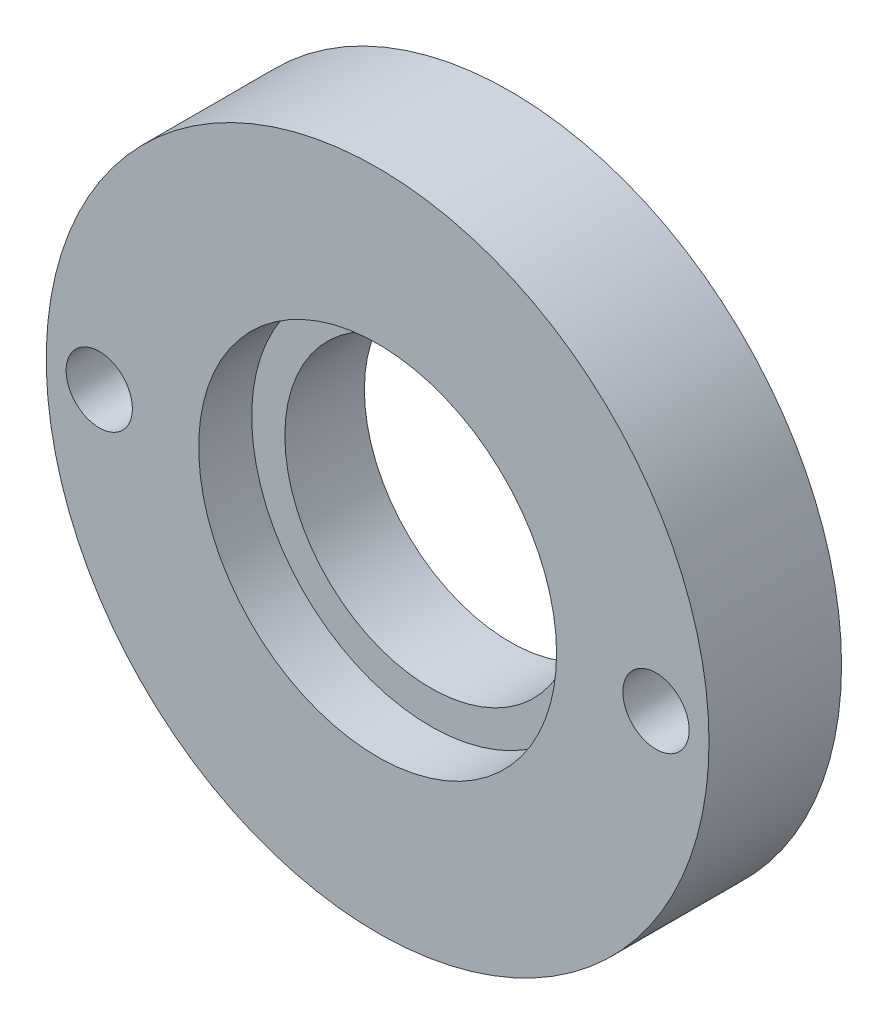
from build123d import *

# Parameters (mm, degrees)
SKETCH_1_R          = 25
EXTRUDE_1_DEPTH     = 10
SKETCH_2_R          = 13.5
CUT_EXTRUDE_1_DEPTH = 4
SKETCH_4_R          = 11
CUT_EXTRUDE_2_DEPTH = 37.742346142
M6X1_0_1_D          = 5


with BuildPart() as part:
    # ｽｹｯﾁ1 → ﾎﾞｽ - 押し出し1 (new body)
    with BuildSketch(Plane.XY):
        Circle(SKETCH_1_R)
    extrude(amount=EXTRUDE_1_DEPTH)

    # ｽｹｯﾁ2 → ｶｯﾄ - 押し出し1 (cut)
    with BuildSketch(Plane.XY.offset(10)):
        Circle(SKETCH_2_R)
    extrude(amount=-CUT_EXTRUDE_1_DEPTH, mode=Mode.SUBTRACT)

    # ｽｹｯﾁ4 → ｶｯﾄ - 押し出し2 (cut, through all)
    with BuildSketch(Plane(origin=(0, 0, 0), x_dir=(-1, 0, 0), z_dir=(0, 0, -1))):
        Circle(SKETCH_4_R)
    extrude(amount=-CUT_EXTRUDE_2_DEPTH, mode=Mode.SUBTRACT)

    # M6x1.0 ねじ穴1 (through all)
    with Locations(Plane(origin=(-21, 0, 10), x_dir=(1, 0, 0), z_dir=(0, 0, 1))):
        with Locations((0, 0), (42, 0)):
            Hole(M6X1_0_1_D / 2)


solid = part.part
